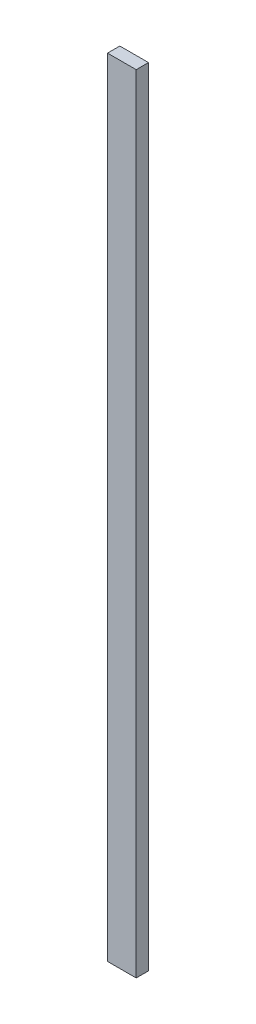
from build123d import *

# Parameters (mm, degrees)
SKETCH1_W           = 88.9
SKETCH1_H           = 38.1
BOSS_EXTRUDE1_DEPTH = 2438.4


with BuildPart() as part:
    # Sketch1 → Boss-Extrude1 (new body)
    with BuildSketch(Plane(origin=(0, 0, 0), x_dir=(1, 0, 0), z_dir=(0, 1, 0))):
        Rectangle(SKETCH1_W, SKETCH1_H)
    extrude(amount=BOSS_EXTRUDE1_DEPTH)


solid = part.part
